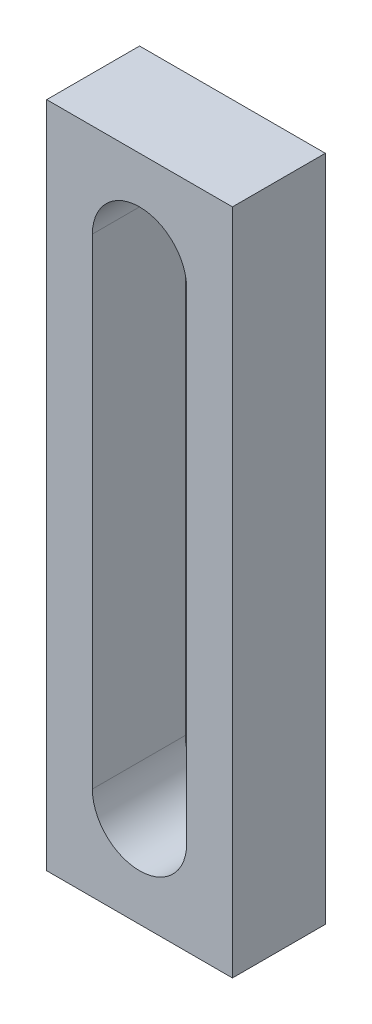
from build123d import *

# Parameters (mm, degrees)
SKETCH1_W               = 50.8
SKETCH1_H               = 182.629999942
BOSS_EXTRUDE1_DEPTH     = 25.4
CUT_EXTRUDE1_DEPTH      = 108.537106246
CUT_EXTRUDE1_DEPTH_BACK = 108.537106246


with BuildPart() as part:
    # Sketch1 → Boss-Extrude1 (new body)
    with BuildSketch(Plane.XY):
        with Locations((25.4, 0)):
            Rectangle(SKETCH1_W, SKETCH1_H)
    extrude(amount=BOSS_EXTRUDE1_DEPTH)

    # Sketch2 → Cut-Extrude1 (cut, two sides: drawn at the far end of the back side and taken through both)
    with BuildSketch(Plane.XY.offset(25.4).offset(-CUT_EXTRUDE1_DEPTH_BACK)):
        with BuildLine():
            Line((38.3, 65.714999971), (38.3, -65.714999971))
            ThreePointArc((38.3, -65.714999971), (25.4, -78.614999971), (12.5, -65.714999971))
            Line((12.5, -65.714999971), (12.5, 65.714999971))
            ThreePointArc((12.5, 65.714999971), (25.4, 78.614999971), (38.3, 65.714999971))
        make_face()
    extrude(amount=CUT_EXTRUDE1_DEPTH + CUT_EXTRUDE1_DEPTH_BACK, mode=Mode.SUBTRACT)


solid = part.part
